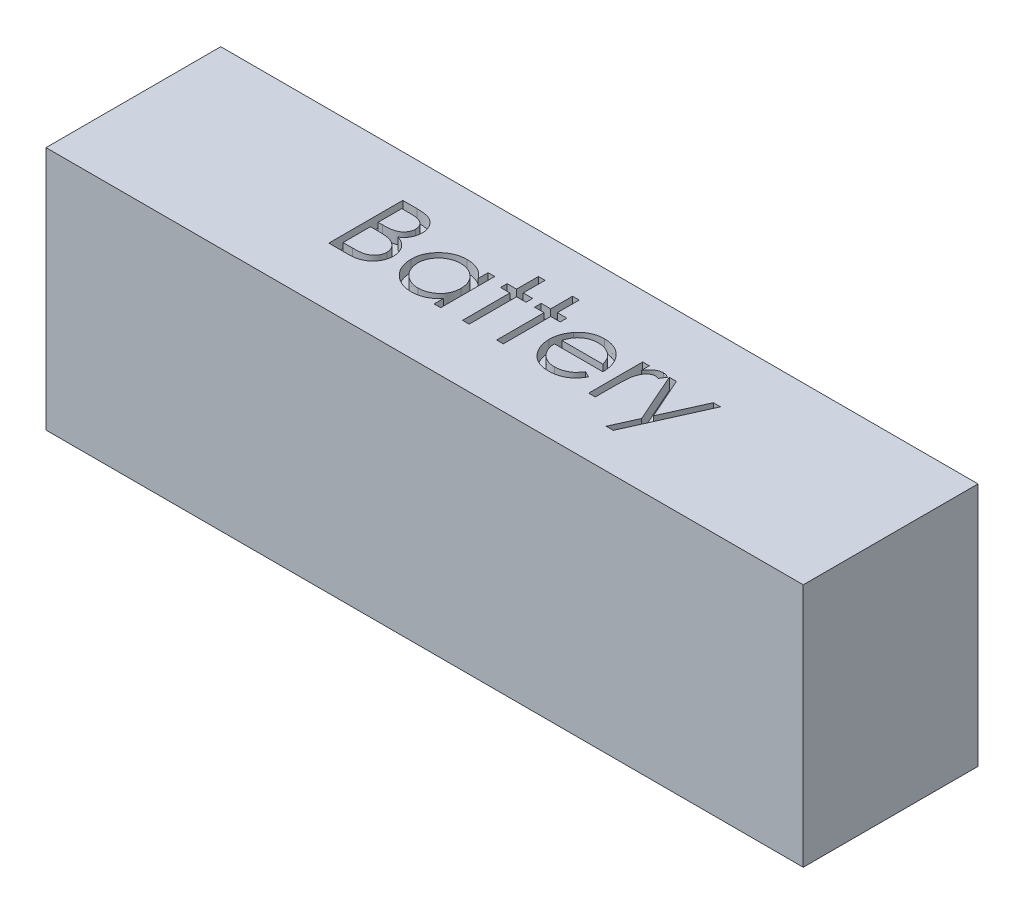
from build123d import *

# Parameters (mm, degrees)
SZKIC1_W                    = 130
SZKIC1_H                    = 30
DODANIE_WYCI_GNI_CIE1_DEPTH = 42
WYTNIJ_WYCI_GNI_CIE1_DEPTH  = 2


with BuildPart() as part:
    # Szkic1 → Dodanie-wyciągnięcie1 (new body)
    with BuildSketch(Plane(origin=(0, 0, 0), x_dir=(1, 0, 0), z_dir=(0, 1, 0))):
        Rectangle(SZKIC1_W, SZKIC1_H)
    extrude(amount=DODANIE_WYCI_GNI_CIE1_DEPTH)

    # Szkic2 → Wytnij-wyciągnięcie1 (cut)
    # profile 1 of 7: a face of its own
    with BuildSketch(Plane(origin=(0, 42, 0), x_dir=(1, 0, 0), z_dir=(0, 1, 0))):
        with BuildLine():
            Line((-26.527562614, 7.773050725), (-24.049637934, 7.773050725))
            add(Edge.make_bspline(
                [(-24.049637934, 7.773050725), (-23.928340313, 7.772413002), (-23.693235336, 7.771176936), (-23.351353361, 7.752006717), (-23.031136248, 7.725867687), (-22.732491132, 7.684392779), (-22.455556012, 7.634348331), (-22.199496299, 7.573744598), (-21.965126246, 7.5010766), (-21.685317173, 7.385520094), (-21.366290775, 7.213804597), (-21.020856608, 6.960063804), (-20.725475511, 6.649703152), (-20.470799445, 6.299608945), (-20.268321097, 5.914487716), (-20.121838218, 5.50351866), (-20.029099642, 5.072002625), (-20.01956218, 4.775754522), (-20.014742101, 4.6260355)],
                knots=[0, 0, 0, 0, 1.001505555, 1.941167018, 2.826882275, 3.653841531, 4.429895133, 5.150066043, 5.825578002, 6.45369114, 7.647487171, 8.808567382, 9.977351308, 11.170798116, 12.373658725, 13.556498008, 14.765093433, 16, 16, 16, 16], degree=3))
            add(Edge.make_bspline(
                [(-20.014742101, 4.6260355), (-20.018708922, 4.485781941), (-20.0265041, 4.210170471), (-20.10104497, 3.80705756), (-20.217742252, 3.423331709), (-20.379958442, 3.060393339), (-20.590785685, 2.7264428), (-20.840643013, 2.418786149), (-21.142093125, 2.150449456), (-21.367947167, 2.000433781), (-21.482670787, 1.924232616)],
                knots=[0, 0, 0, 0, 1.044552857, 2.05264487, 3.044412934, 4.028983338, 5.005914585, 5.980388656, 6.974128949, 8, 8, 8, 8], degree=3))
            add(Edge.make_bspline(
                [(-21.482670787, 1.924232616), (-21.338397235, 1.868842477), (-21.062366192, 1.76286742), (-20.682505518, 1.57550445), (-20.355227081, 1.371716221), (-20.07801458, 1.149169222), (-19.840932232, 0.90928868), (-19.633911558, 0.648557266), (-19.457267715, 0.363573773), (-19.305909392, 0.057309516), (-19.187803906, -0.267108241), (-19.099354196, -0.606636486), (-19.048672309, -0.960057729), (-19.04146001, -1.200578962), (-19.037819024, -1.322001359)],
                knots=[0, 0, 0, 0, 1.27268992, 2.434971085, 3.483601985, 4.442670788, 5.356604649, 6.2567628, 7.179492994, 8.113709626, 9.066344395, 10.018646069, 10.999752585, 12, 12, 12, 12], degree=3))
            add(Edge.make_bspline(
                [(-19.037819024, -1.322001359), (-19.04136358, -1.445978295), (-19.048337592, -1.689906389), (-19.099790633, -2.048246449), (-19.186909392, -2.390692684), (-19.306910409, -2.719460061), (-19.463527951, -3.033912549), (-19.654129421, -3.334406393), (-19.881392523, -3.617922392), (-20.135620648, -3.887610968), (-20.423229004, -4.130100367), (-20.733529029, -4.34605736), (-21.070428533, -4.523661643), (-21.42839434, -4.672854064), (-21.811442001, -4.786817327), (-22.217851462, -4.86654638), (-22.647272215, -4.920267515), (-22.941947597, -4.92468423), (-23.093067421, -4.926949275)],
                knots=[0, 0, 0, 0, 0.978564426, 1.925352924, 2.850884081, 3.763762016, 4.682927383, 5.618979971, 6.567305752, 7.547517671, 8.540179244, 9.531824382, 10.526200242, 11.540722885, 12.589160233, 13.674978461, 14.80764778, 16, 16, 16, 16], degree=3))
            Line((-23.093067421, -4.926949275), (-26.527562614, -4.926949275))
            Line((-26.527562614, -4.926949275), (-26.527562614, 7.773050725))
        make_face()
        with BuildLine():
            Line((-25.387819024, 6.470486622), (-25.387819024, 2.399973802))
            Line((-25.387819024, 2.399973802), (-24.6220538, 2.399973802))
            add(Edge.make_bspline(
                [(-24.6220538, 2.399973802), (-24.510116742, 2.401424951), (-24.293831536, 2.404228867), (-23.980613625, 2.412260772), (-23.689874274, 2.434750815), (-23.422115337, 2.457234394), (-23.177758468, 2.493790755), (-22.957345028, 2.53730503), (-22.757415834, 2.583325857), (-22.526858054, 2.661592281), (-22.265336212, 2.777262702), (-21.986541806, 2.956774793), (-21.740762445, 3.170586018), (-21.533218364, 3.417296079), (-21.363359599, 3.688953382), (-21.245381261, 3.981223491), (-21.165381116, 4.286822256), (-21.158154702, 4.496619916), (-21.154485691, 4.603138866)],
                knots=[0, 0, 0, 0, 1.156816544, 2.235205308, 3.236616184, 4.169592532, 5.011045266, 5.787822928, 6.49130361, 7.128639758, 8.301311294, 9.436451833, 10.541879658, 11.654887649, 12.756523258, 13.837046038, 14.901820046, 16, 16, 16, 16], degree=3))
            add(Edge.make_bspline(
                [(-21.154485691, 4.603138866), (-21.156394973, 4.673626665), (-21.160140239, 4.811896181), (-21.190813651, 5.013460981), (-21.242947421, 5.203031168), (-21.309910143, 5.383204654), (-21.403486242, 5.548347654), (-21.513662237, 5.704170107), (-21.646778885, 5.845365508), (-21.798298276, 5.97733483), (-21.972500994, 6.094336403), (-22.16928311, 6.196810029), (-22.391306966, 6.279326562), (-22.634830754, 6.351593744), (-22.903602986, 6.402351267), (-23.19452208, 6.444636416), (-23.509970918, 6.466163794), (-23.728211718, 6.46901354), (-23.841024152, 6.470486622)],
                knots=[0, 0, 0, 0, 0.91205012, 1.789085906, 2.630437955, 3.453916878, 4.269457761, 5.079663411, 5.91843418, 6.774407191, 7.675494373, 8.627863946, 9.638891023, 10.736472738, 11.911756761, 13.175263542, 14.539845004, 16, 16, 16, 16], degree=3))
            Line((-23.841024152, 6.470486622), (-25.387819024, 6.470486622))
        make_face(mode=Mode.SUBTRACT)
        with BuildLine():
            Line((-25.387819024, 1.097409699), (-25.387819024, -3.624385173))
            Line((-25.387819024, -3.624385173), (-23.764702037, -3.624385173))
            add(Edge.make_bspline(
                [(-23.764702037, -3.624385173), (-23.648519077, -3.622992718), (-23.424591739, -3.620308945), (-23.101281561, -3.611547561), (-22.80162287, -3.591618446), (-22.526983063, -3.560246363), (-22.274396564, -3.526215991), (-22.04689347, -3.480455057), (-21.842629596, -3.428025972), (-21.605777108, -3.346984832), (-21.339064378, -3.221086209), (-21.051642128, -3.031260302), (-20.796095565, -2.805115728), (-20.57908791, -2.543383554), (-20.40124078, -2.258789882), (-20.271862415, -1.957091041), (-20.19206702, -1.643272127), (-20.182407149, -1.429307198), (-20.177562614, -1.322001359)],
                knots=[0, 0, 0, 0, 1.160039823, 2.235823828, 3.228722157, 4.157150951, 4.99529583, 5.772374946, 6.472645482, 7.099169577, 8.269452708, 9.405989375, 10.527446681, 11.663510218, 12.788923519, 13.866172445, 14.929861265, 16, 16, 16, 16], degree=3))
            add(Edge.make_bspline(
                [(-20.177562614, -1.322001359), (-20.178564478, -1.254896952), (-20.180552047, -1.121770538), (-20.210526278, -0.926133137), (-20.254119463, -0.736627825), (-20.31047638, -0.552740024), (-20.392552732, -0.377794344), (-20.488370767, -0.208330771), (-20.600716424, -0.044125288), (-20.775773826, 0.16347346), (-21.030397884, 0.40265805), (-21.392191041, 0.636836987), (-21.803570522, 0.825696172), (-22.101938853, 0.905885701), (-22.256068223, 0.947309539)],
                knots=[0, 0, 0, 0, 0.723448775, 1.435228256, 2.130040452, 2.821711965, 3.505591119, 4.210454504, 4.921174351, 5.648778258, 7.137944449, 8.670945889, 10.280296675, 12, 12, 12, 12], degree=3))
            add(Edge.make_bspline(
                [(-22.256068223, 0.947309539), (-22.317859513, 0.959846558), (-22.451835777, 0.987029401), (-22.670303283, 1.015723067), (-22.919716293, 1.04128657), (-23.200650733, 1.060195628), (-23.513462043, 1.079741086), (-23.85881829, 1.087342294), (-24.235309118, 1.096411038), (-24.496538584, 1.097068297), (-24.632230082, 1.097409699)],
                knots=[0, 0, 0, 0, 0.634451884, 1.375622551, 2.216452059, 3.157844607, 4.20941857, 5.370758133, 6.634282058, 8, 8, 8, 8], degree=3))
            Line((-24.632230082, 1.097409699), (-25.387819024, 1.097409699))
        make_face(mode=Mode.SUBTRACT)
    # profile 2 of 7: a face of its own
    with BuildSketch(Plane(origin=(0, 42, 0), x_dir=(1, 0, 0), z_dir=(0, 1, 0))):
        with BuildLine():
            Line((-7.314742101, 4.353819956), (-7.314742101, -4.926949275))
            Line((-7.314742101, -4.926949275), (-8.454485691, -4.926949275))
            Line((-8.454485691, -4.926949275), (-8.454485691, -3.321640782))
            add(Edge.make_bspline(
                [(-8.454485691, -3.321640782), (-8.583005302, -3.466927308), (-8.833812941, -3.750455792), (-9.252699283, -4.120868246), (-9.696720957, -4.427041013), (-10.163722894, -4.67432785), (-10.653283377, -4.860081883), (-11.164317179, -4.99211166), (-11.697032761, -5.076997862), (-12.060805591, -5.085474285), (-12.245150755, -5.089769788)],
                knots=[0, 0, 0, 0, 1.074387032, 2.096679803, 3.090159297, 4.057316773, 5.018401886, 5.985159533, 6.978961417, 8, 8, 8, 8], degree=3))
            add(Edge.make_bspline(
                [(-12.245150755, -5.089769788), (-12.409045902, -5.085319809), (-12.732254388, -5.076544252), (-13.207702754, -5.008463893), (-13.665237487, -4.899132781), (-14.105290937, -4.74709241), (-14.525015579, -4.545413429), (-14.928005072, -4.303963757), (-15.312171698, -4.016432745), (-15.671659853, -3.687727614), (-16.002701683, -3.330694375), (-16.29320973, -2.949891962), (-16.535428048, -2.54696703), (-16.737975198, -2.127021015), (-16.893990505, -1.686821164), (-17.002751978, -1.227889726), (-17.070753027, -0.750769328), (-17.079524956, -0.425868773), (-17.08397287, -0.261123955)],
                knots=[0, 0, 0, 0, 1.033919861, 2.038935746, 3.024066025, 3.998881131, 4.97069526, 5.957263378, 6.95902576, 7.993208707, 9.027059324, 10.027763471, 11.009749337, 11.988697705, 12.965288445, 13.950418724, 14.960734635, 16, 16, 16, 16], degree=3))
            add(Edge.make_bspline(
                [(-17.08397287, -0.261123955), (-17.079426374, -0.09978423), (-17.070438196, 0.219175701), (-17.00347937, 0.688272691), (-16.890881139, 1.140096094), (-16.732864663, 1.573191288), (-16.530238141, 1.988082327), (-16.283756225, 2.385062647), (-15.993401115, 2.765225889), (-15.658656667, 3.119632912), (-15.296036215, 3.447004855), (-14.908110249, 3.731517677), (-14.504528628, 3.9772331), (-14.079031418, 4.171918571), (-13.637916495, 4.329431608), (-13.177256849, 4.438408378), (-12.698969121, 4.502624372), (-12.374246478, 4.511923545), (-12.209533768, 4.516640468)],
                knots=[0, 0, 0, 0, 1.020392517, 2.01726096, 2.990465484, 3.961182959, 4.928053699, 5.906110375, 6.912531644, 7.948652711, 8.985773172, 9.998621852, 10.987621588, 11.969261332, 12.953316658, 13.946091881, 14.958173133, 16, 16, 16, 16], degree=3))
            add(Edge.make_bspline(
                [(-12.209533768, 4.516640468), (-12.02012285, 4.511423484), (-11.648696981, 4.501193224), (-11.105398205, 4.416057042), (-10.591431099, 4.272226033), (-10.102828165, 4.07658254), (-9.641343961, 3.816600009), (-9.211347418, 3.488649865), (-8.808338379, 3.094800415), (-8.574729892, 2.792284802), (-8.454485691, 2.636572359)],
                knots=[0, 0, 0, 0, 1.038897134, 2.037228247, 3.008116434, 3.962042015, 4.918381754, 5.904844433, 6.921570401, 8, 8, 8, 8], degree=3))
            Line((-8.454485691, 2.636572359), (-8.454485691, 4.353819956))
            Line((-8.454485691, 4.353819956), (-7.314742101, 4.353819956))
        make_face()
        with BuildLine():
            add(Edge.make_bspline(
                [(-12.194269345, 3.376896879), (-12.360872799, 3.370969107), (-12.689721519, 3.35926863), (-13.172481184, 3.267924805), (-13.634447, 3.115943562), (-14.07330847, 2.908092092), (-14.482133142, 2.646730676), (-14.847507319, 2.330604514), (-15.172419407, 1.968338777), (-15.445680822, 1.561568262), (-15.668440626, 1.125493475), (-15.825075284, 0.669656228), (-15.928377982, 0.202278167), (-15.938931757, -0.114723579), (-15.94422928, -0.273844307)],
                knots=[0, 0, 0, 0, 1.031046209, 2.035121221, 3.029706178, 4.034933723, 5.034054252, 6.02443088, 7.017295772, 8.038157696, 9.050218397, 10.03989886, 11.016116709, 12, 12, 12, 12], degree=3))
            add(Edge.make_bspline(
                [(-15.94422928, -0.273844307), (-15.937462382, -0.432014125), (-15.923955109, -0.747733787), (-15.826888303, -1.215749023), (-15.664038477, -1.67169369), (-15.441817278, -2.111697867), (-15.163554382, -2.520217316), (-14.841015557, -2.889388618), (-14.471081679, -3.206850839), (-14.061316154, -3.472598606), (-13.623681518, -3.687274039), (-13.163455538, -3.836646502), (-12.689289651, -3.933085877), (-12.366882611, -3.944350693), (-12.204445627, -3.950026198)],
                knots=[0, 0, 0, 0, 0.979072187, 1.954306742, 2.945804271, 3.96968567, 4.997920485, 5.998718438, 6.996577872, 8.005894225, 9.015743152, 10.005417472, 10.995077863, 12, 12, 12, 12], degree=3))
            add(Edge.make_bspline(
                [(-12.204445627, -3.950026198), (-12.039539745, -3.944002901), (-11.711558303, -3.932023159), (-11.22736642, -3.840288282), (-10.757484698, -3.688727214), (-10.308313898, -3.478636097), (-9.889881079, -3.218259405), (-9.514331637, -2.913433675), (-9.196773695, -2.558910693), (-8.927560511, -2.169287563), (-8.716466857, -1.742161176), (-8.562702299, -1.287377112), (-8.471792412, -0.80491954), (-8.460334365, -0.475213291), (-8.454485691, -0.306917224)],
                knots=[0, 0, 0, 0, 1.01762866, 2.023962475, 3.030623092, 4.058876274, 5.077231937, 6.066672613, 7.034107872, 8.005628644, 8.981990164, 9.965428785, 10.961468474, 12, 12, 12, 12], degree=3))
            add(Edge.make_bspline(
                [(-8.454485691, -0.306917224), (-8.457967872, -0.178691382), (-8.464821908, 0.073697654), (-8.51718426, 0.444274646), (-8.60047785, 0.798908452), (-8.717848239, 1.137971923), (-8.872030899, 1.459590408), (-9.057987078, 1.766073195), (-9.278986853, 2.055826276), (-9.531472636, 2.324859705), (-9.807843514, 2.570247154), (-10.100286561, 2.789283113), (-10.412266586, 2.969219517), (-10.738536977, 3.118140702), (-11.079663819, 3.23664676), (-11.438422926, 3.315704964), (-11.811000964, 3.369989557), (-12.065168079, 3.374570196), (-12.194269345, 3.376896879)],
                knots=[0, 0, 0, 0, 1.050140795, 2.067009409, 3.05949893, 4.030605086, 5.00011959, 5.97591094, 6.962425594, 7.979863591, 8.993523472, 9.986985069, 10.967611495, 11.937549037, 12.921786183, 13.919465291, 14.943216303, 16, 16, 16, 16], degree=3))
        make_face(mode=Mode.SUBTRACT)
    # profile 3 of 7: a face of its own
    with BuildSketch(Plane(origin=(0, 42, 0), x_dir=(1, 0, 0), z_dir=(0, 1, 0))):
        Polygon((-3.569870306, 8.09869175), (-2.430126716, 8.09869175), (-2.430126716, 4.353819956), (-0.801921588, 4.353819956), (-0.801921588, 3.214076366), (-2.430126716, 3.214076366), (-2.430126716, -4.926949275), (-3.569870306, -4.926949275), (-3.569870306, 3.214076366), (-5.198075434, 3.214076366), (-5.198075434, 4.353819956), (-3.569870306, 4.353819956), align=None)
    # profile 4 of 7: a face of its own
    with BuildSketch(Plane(origin=(0, 42, 0), x_dir=(1, 0, 0), z_dir=(0, 1, 0))):
        Polygon((2.291668155, 8.09869175), (3.431411745, 8.09869175), (3.431411745, 4.353819956), (5.059616873, 4.353819956), (5.059616873, 3.214076366), (3.431411745, 3.214076366), (3.431411745, -4.926949275), (2.291668155, -4.926949275), (2.291668155, 3.214076366), (0.663463027, 3.214076366), (0.663463027, 4.353819956), (2.291668155, 4.353819956), align=None)
    # profile 5 of 7: a face of its own
    with BuildSketch(Plane(origin=(0, 42, 0), x_dir=(1, 0, 0), z_dir=(0, 1, 0))):
        with BuildLine():
            Line((14.630410143, -1.996180044), (15.642950207, -2.527890782))
            add(Edge.make_bspline(
                [(15.642950207, -2.527890782), (15.562263133, -2.671013727), (15.405278039, -2.9494743), (15.135309611, -3.332041336), (14.852309805, -3.676203048), (14.543503978, -3.972764936), (14.218131143, -4.231305676), (13.874386938, -4.457502926), (13.5104818, -4.650247271), (13.126398513, -4.812635015), (12.71891157, -4.937492322), (12.287033496, -5.025681924), (11.829936927, -5.080194927), (11.516623646, -5.086527295), (11.356191393, -5.089769788)],
                knots=[0, 0, 0, 0, 1.120438281, 2.179929193, 3.190490725, 4.156257408, 5.095198341, 6.022838206, 6.959905092, 7.901321166, 8.864066838, 9.862729781, 10.905609505, 12, 12, 12, 12], degree=3))
            add(Edge.make_bspline(
                [(11.356191393, -5.089769788), (11.177876217, -5.08560718), (10.830034968, -5.077487139), (10.323705028, -5.007483054), (9.846985424, -4.893283352), (9.399902958, -4.733751244), (8.983552498, -4.525372097), (8.597106539, -4.27151912), (8.238532831, -3.973496367), (7.919130701, -3.628722415), (7.631588612, -3.25976217), (7.37785778, -2.875293675), (7.165740816, -2.476284261), (6.993192773, -2.065274073), (6.853837977, -1.64485366), (6.756713081, -1.211197763), (6.700725138, -0.765480072), (6.692145578, -0.463955453), (6.687822002, -0.312005365)],
                knots=[0, 0, 0, 0, 1.145258523, 2.234067595, 3.276747158, 4.290159414, 5.277019952, 6.260822364, 7.254936242, 8.264827045, 9.274100331, 10.257902744, 11.220704747, 12.172965371, 13.118907548, 14.062713208, 15.023725156, 16, 16, 16, 16], degree=3))
            add(Edge.make_bspline(
                [(6.687822002, -0.312005365), (6.691665172, -0.169421266), (6.699281827, 0.113161589), (6.747290684, 0.53141085), (6.83237449, 0.937914092), (6.94912858, 1.333009089), (7.099900245, 1.716034318), (7.284348583, 2.087222892), (7.502760925, 2.446179828), (7.671390342, 2.672614056), (7.756331617, 2.78667252)],
                knots=[0, 0, 0, 0, 1.024358464, 2.0301432, 3.019427413, 4.004406732, 4.986367066, 5.972626655, 6.978780325, 8, 8, 8, 8], degree=3))
            add(Edge.make_bspline(
                [(7.756331617, 2.78667252), (7.871385209, 2.92408242), (8.097847786, 3.194549423), (8.480866562, 3.549925633), (8.895612988, 3.847627332), (9.33688946, 4.094396083), (9.809824666, 4.281897602), (10.308061236, 4.421625115), (10.837272364, 4.499922469), (11.199059879, 4.510981751), (11.384176168, 4.516640468)],
                knots=[0, 0, 0, 0, 1.030682036, 2.02871468, 2.997146059, 3.962720338, 4.930598197, 5.918074684, 6.934738563, 8, 8, 8, 8], degree=3))
            add(Edge.make_bspline(
                [(11.384176168, 4.516640468), (11.57448605, 4.511727205), (11.947830657, 4.502088503), (12.492232925, 4.412730093), (13.007347525, 4.27102511), (13.492968326, 4.070895641), (13.949144564, 3.812688125), (14.372911086, 3.492859157), (14.771515146, 3.121227812), (15.00341199, 2.835429881), (15.121415752, 2.68999784)],
                knots=[0, 0, 0, 0, 1.056321875, 2.072262726, 3.055038591, 4.01806755, 4.982017516, 5.957941055, 6.960871419, 8, 8, 8, 8], degree=3))
            add(Edge.make_bspline(
                [(15.121415752, 2.68999784), (15.201704928, 2.580401988), (15.361748851, 2.361939786), (15.5622169, 2.00571873), (15.736233733, 1.633026002), (15.87532762, 1.237837209), (15.987956667, 0.824834733), (16.069442838, 0.391066071), (16.11722974, -0.063339608), (16.126623013, -0.372953109), (16.131411745, -0.530795429)],
                knots=[0, 0, 0, 0, 0.94817472, 1.890038105, 2.849395472, 3.817997239, 4.812318967, 5.836947057, 6.897266129, 8, 8, 8, 8], degree=3))
            Line((16.131411745, -0.530795429), (7.827565591, -0.530795429))
            add(Edge.make_bspline(
                [(7.827565591, -0.530795429), (7.833152163, -0.653079971), (7.844137932, -0.89354759), (7.895355737, -1.245413003), (7.976087002, -1.580596273), (8.089549029, -1.896583311), (8.226951582, -2.197501202), (8.395265468, -2.481117737), (8.596068993, -2.746141083), (8.820045102, -2.994941839), (9.069353705, -3.216505173), (9.331636816, -3.414813046), (9.610650609, -3.581021926), (9.904195084, -3.715931812), (10.211795561, -3.821546158), (10.533548955, -3.893637965), (10.86882212, -3.941923753), (11.097370355, -3.947292824), (11.213723444, -3.950026198)],
                knots=[0, 0, 0, 0, 1.094153842, 2.151609401, 3.174256925, 4.172055639, 5.149267565, 6.128595816, 7.11444997, 8.118368179, 9.117203808, 10.09244225, 11.054858984, 12.015122123, 12.976791628, 13.957293641, 14.960065497, 16, 16, 16, 16], degree=3))
            add(Edge.make_bspline(
                [(11.213723444, -3.950026198), (11.327483322, -3.947819821), (11.553204744, -3.943441946), (11.889358712, -3.900871869), (12.220064997, -3.832036869), (12.54395485, -3.738093191), (12.854454777, -3.623514327), (13.142002916, -3.485255387), (13.406453984, -3.33231202), (13.653621263, -3.157379771), (13.893364582, -2.943264349), (14.131190175, -2.676071876), (14.386194032, -2.360068561), (14.545813411, -2.12223143), (14.630410143, -1.996180044)],
                knots=[0, 0, 0, 0, 0.99110716, 1.966546729, 2.947904876, 3.932708344, 4.903319531, 5.828989031, 6.710028674, 7.56322171, 8.463672341, 9.504779593, 10.677557249, 12, 12, 12, 12], degree=3))
        make_face()
        with BuildLine():
            add(Edge.make_bspline(
                [(14.991668155, 0.608948161), (14.949951832, 0.760124874), (14.869661338, 1.051091383), (14.701889387, 1.454011185), (14.512944082, 1.812107283), (14.289345228, 2.122639095), (14.036002995, 2.39842327), (13.74337619, 2.639427851), (13.415223091, 2.855028316), (13.053239923, 3.037010243), (12.66991116, 3.191913444), (12.268568692, 3.295781722), (11.859056147, 3.366936346), (11.582071737, 3.373562511), (11.44268979, 3.376896879)],
                knots=[0, 0, 0, 0, 1.154881502, 2.222775134, 3.210006277, 4.132804581, 5.035138423, 5.962687519, 6.919655026, 7.923214229, 8.944639381, 9.960483929, 10.97369054, 12, 12, 12, 12], degree=3))
            add(Edge.make_bspline(
                [(11.44268979, 3.376896879), (11.328936113, 3.374677385), (11.104069009, 3.370289912), (10.772776562, 3.328669728), (10.454624512, 3.259872577), (10.147265325, 3.165656877), (9.854726746, 3.040077091), (9.570991444, 2.892817955), (9.303274006, 2.713052779), (9.13584702, 2.576042077), (9.051263508, 2.506824763)],
                knots=[0, 0, 0, 0, 1.04873581, 2.073130211, 3.073294108, 4.04793562, 5.032784715, 6.005352987, 6.992311501, 8, 8, 8, 8], degree=3))
            add(Edge.make_bspline(
                [(9.051263508, 2.506824763), (8.990690742, 2.452053961), (8.868106226, 2.341211205), (8.70431062, 2.15024237), (8.547482048, 1.944315273), (8.404757079, 1.715551535), (8.27384698, 1.466556137), (8.151346491, 1.199429289), (8.041087224, 0.912143931), (7.979052768, 0.711946794), (7.947136905, 0.608948161)],
                knots=[0, 0, 0, 0, 0.879870761, 1.780643979, 2.707998968, 3.669668524, 4.684282772, 5.740141944, 6.837334558, 8, 8, 8, 8], degree=3))
            Line((7.947136905, 0.608948161), (14.991668155, 0.608948161))
        make_face(mode=Mode.SUBTRACT)
    # profile 6 of 7: a face of its own
    with BuildSketch(Plane(origin=(0, 42, 0), x_dir=(1, 0, 0), z_dir=(0, 1, 0))):
        with BuildLine():
            Line((18.085257899, 4.353819956), (19.225001489, 4.353819956))
            Line((19.225001489, 4.353819956), (19.225001489, 2.98765409))
            add(Edge.make_bspline(
                [(19.225001489, 2.98765409), (19.309143556, 3.114856667), (19.470064606, 3.358130608), (19.737537236, 3.6798735), (20.011506466, 3.94626524), (20.29328386, 4.158549437), (20.584941537, 4.317528468), (20.880078476, 4.433980338), (21.183338038, 4.502840882), (21.387125592, 4.512034444), (21.489224245, 4.516640468)],
                knots=[0, 0, 0, 0, 1.2804753, 2.448899062, 3.506932113, 4.484331642, 5.4025378, 6.288909075, 7.142734305, 8, 8, 8, 8], degree=3))
            add(Edge.make_bspline(
                [(21.489224245, 4.516640468), (21.56842263, 4.512320558), (21.731378453, 4.50343206), (21.978058136, 4.440981354), (22.232215805, 4.341275386), (22.396018181, 4.247512293), (22.481411745, 4.198631654)],
                knots=[0, 0, 0, 0, 0.901110191, 1.854092781, 2.881294221, 4, 4, 4, 4], degree=3))
            Line((22.481411745, 4.198631654), (21.855570399, 3.211532295))
            add(Edge.make_bspline(
                [(21.855570399, 3.211532295), (21.800746237, 3.235989832), (21.696679481, 3.28241492), (21.544444341, 3.337358785), (21.404086347, 3.369710823), (21.314665435, 3.374611997), (21.272978252, 3.376896879)],
                knots=[0, 0, 0, 0, 1.180555205, 2.24091978, 3.179933427, 4, 4, 4, 4], degree=3))
            add(Edge.make_bspline(
                [(21.272978252, 3.376896879), (21.181517447, 3.370800743), (20.994963918, 3.358366394), (20.72106302, 3.260617005), (20.455280303, 3.102682563), (20.244200271, 2.927527385), (20.080761239, 2.758625377), (19.964138135, 2.611129745), (19.857157882, 2.445744425), (19.754940225, 2.265296715), (19.661808243, 2.06670556), (19.574887015, 1.851955042), (19.496296284, 1.620796432), (19.45148254, 1.459751288), (19.42852713, 1.377257456)],
                knots=[0, 0, 0, 0, 1.125678352, 2.296057538, 3.5422874, 4.923748041, 5.663163013, 6.437101912, 7.23742474, 8.08941207, 8.991984279, 9.93940061, 10.944477711, 12, 12, 12, 12], degree=3))
            add(Edge.make_bspline(
                [(19.42852713, 1.377257456), (19.411355302, 1.303680283), (19.37332101, 1.140712436), (19.336340287, 0.867304932), (19.299802321, 0.544276228), (19.274051735, 0.170727162), (19.250182839, -0.25240942), (19.236720541, -0.725778137), (19.225460574, -1.249864868), (19.22515916, -1.616257522), (19.225001489, -1.807918826)],
                knots=[0, 0, 0, 0, 0.566838948, 1.255505196, 2.06880316, 3.007127437, 4.065329342, 5.249902469, 6.561414163, 8, 8, 8, 8], degree=3))
            Line((19.225001489, -1.807918826), (19.225001489, -4.926949275))
            Line((19.225001489, -4.926949275), (18.085257899, -4.926949275))
            Line((18.085257899, -4.926949275), (18.085257899, 4.353819956))
        make_face()
    # profile 7 of 7: a face of its own
    with BuildSketch(Plane(origin=(0, 42, 0), x_dir=(1, 0, 0), z_dir=(0, 1, 0))):
        Polygon((22.644232258, 4.353819956), (23.870474245, 4.353819956), (27.01748947, -2.754313057), (30.205209822, 4.353819956), (31.43653995, 4.353819956), (25.737822002, -8.346180044), (24.506491873, -8.346180044), (26.401824405, -4.130655205), align=None)
    extrude(amount=-WYTNIJ_WYCI_GNI_CIE1_DEPTH, mode=Mode.SUBTRACT)


solid = part.part
